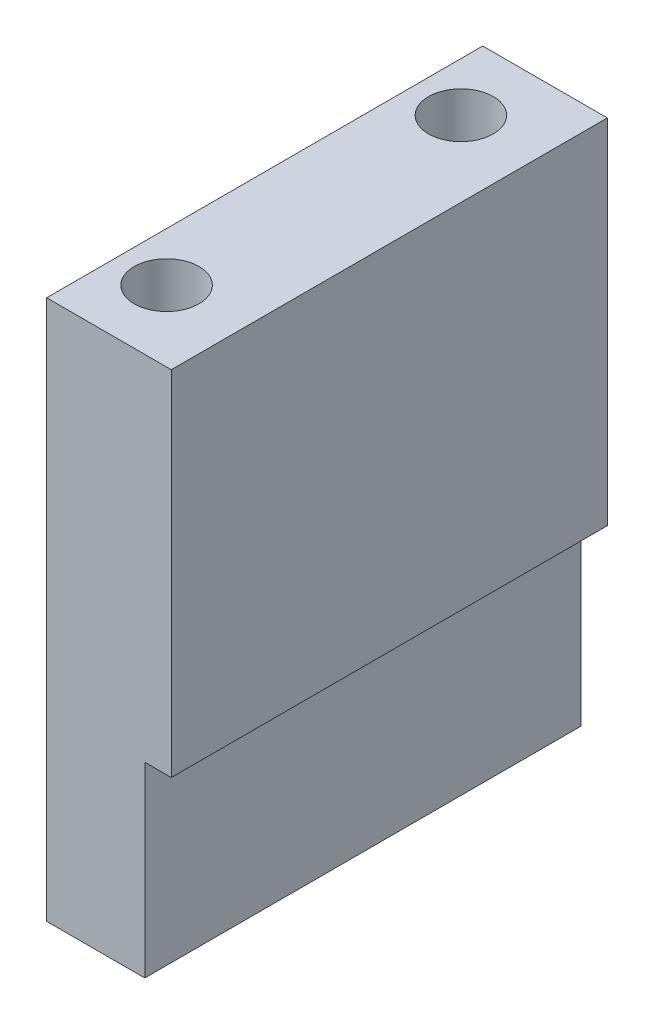
from build123d import *

# Parameters (mm, degrees)
SKETCH1_W            = 44.45
SKETCH1_H            = 55.05
BOSS_EXTRUDE1_DEPTH  = 6.35
SKETCH2_W            = 2.7
SKETCH2_H            = 19.05
CUT_EXTRUDE1_DEPTH   = 53.666408886
M6_CLEARANCE_HOLE1_D = 6.6


with BuildPart() as part:
    # Sketch1 → Boss-Extrude1 (new, symmetric)
    with BuildSketch(Plane(origin=(0, 0, 0), x_dir=(0, 0, -1), z_dir=(1, 0, 0))):
        Rectangle(SKETCH1_W, SKETCH1_H)
    extrude(amount=BOSS_EXTRUDE1_DEPTH, both=True)

    # Sketch2 → Cut-Extrude1 (cut, through all)
    with BuildSketch(Plane(origin=(0, 0, -22.225), x_dir=(-1, 0, 0), z_dir=(0, 0, -1))):
        with Locations((-5, -18)):
            Rectangle(SKETCH2_W, SKETCH2_H)
    extrude(amount=-CUT_EXTRUDE1_DEPTH, mode=Mode.SUBTRACT)

    # M6 Clearance Hole1 (through all)
    with Locations(Plane(origin=(0, -27.525, 0), x_dir=(-1, 0, 0), z_dir=(0, -1, 0))):
        with Locations((1.35, 15), (1.35, -15)):
            Hole(M6_CLEARANCE_HOLE1_D / 2)


solid = part.part
